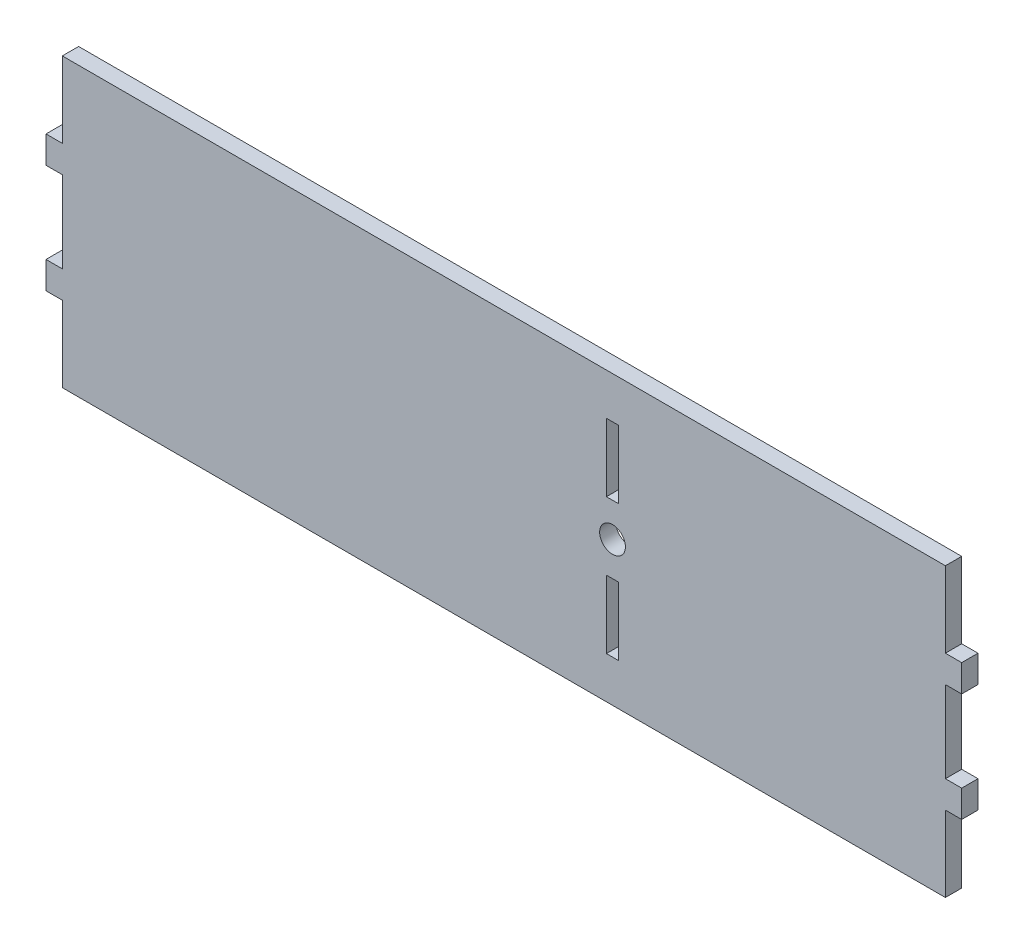
from build123d import *

# Parameters (mm, degrees)
SKETCH1_W           = 1.8
SKETCH1_H           = 10
SKETCH1_R           = 1.9
BOSS_EXTRUDE1_DEPTH = 2.4


with BuildPart() as part:
    # Sketch1 → Boss-Extrude1 (new body)
    with BuildSketch(Plane.XY):
        Polygon((65, 21.15), (-65, 21.15), (-65, 10), (-67.4, 10), (-67.4, 6), (-65, 6), (-65, -6), (-67.4, -6), (-67.4, -10), (-65, -10), (-65, -21.15), (65, -21.15), (65, -10), (67.4, -10), (67.4, -6), (65, -6), (65, 6), (67.4, 6), (67.4, 10), (65, 10), align=None)
        with Locations((16, -10)):
            Rectangle(SKETCH1_W, SKETCH1_H, mode=Mode.SUBTRACT)
        with Locations((16, 0)):
            Circle(SKETCH1_R, mode=Mode.SUBTRACT)
        Polygon((16.9, 5), (16, 5), (15.1, 5), (15.1, 15), (16.9, 15), align=None, mode=Mode.SUBTRACT)
    extrude(amount=BOSS_EXTRUDE1_DEPTH)


solid = part.part
